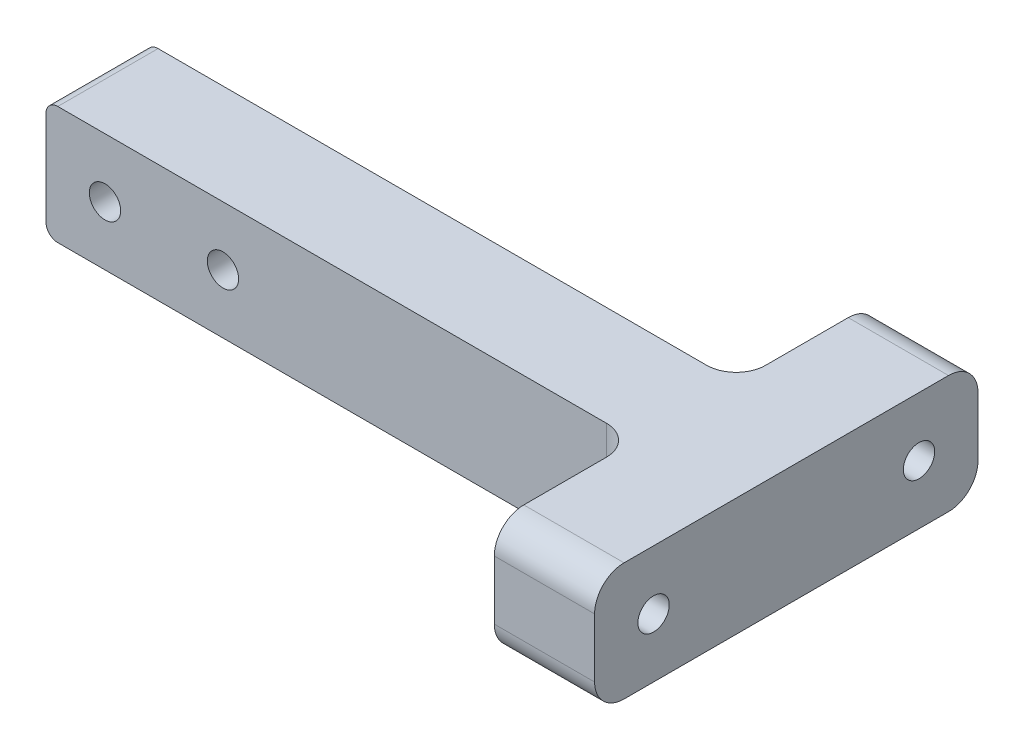
from build123d import *

# Parameters (mm, degrees)
BOSS_EXTRUDE1_DEPTH = 25.4
FILLET1_R           = 6.35
SKETCH2_R           = 3.3734375
CUT_EXTRUDE1_DEPTH  = 160.484898972
SKETCH3_R           = 3.3734375
CUT_EXTRUDE2_DEPTH  = 157.293869761
FILLET2_R           = 6.35
FILLET3_R           = 2.54


with BuildPart() as part:
    # Sketch1 → Boss-Extrude1 (new body)
    with BuildSketch(Plane(origin=(0, 0, 0), x_dir=(1, 0, 0), z_dir=(0, 1, 0))):
        Polygon((0, 10.795), (0, -10.795), (127, -10.795), (127, -41.275), (148.59, -41.275), (148.59, 41.275), (127, 41.275), (127, 10.795), align=None)
    extrude(amount=BOSS_EXTRUDE1_DEPTH)

    # Fillet1
    fillet1_edges = [part.edges().sort_by_distance(p)[0] for p in [
        (127, 12.7, -10.795),
        (127, 12.7, 10.795),
    ]]
    fillet(fillet1_edges, radius=FILLET1_R)

    # Sketch2 → Cut-Extrude1 (cut, through all)
    with BuildSketch(Plane.XY.offset(10.795)):
        with Locations((12.7, 12.7)):
            Circle(SKETCH2_R)
        with Locations((38.1, 12.7)):
            Circle(SKETCH2_R)
    extrude(amount=-CUT_EXTRUDE1_DEPTH, mode=Mode.SUBTRACT)

    # Sketch3 → Cut-Extrude2 (cut, through all)
    with BuildSketch(Plane(origin=(148.59, 0, 0), x_dir=(0, 0, -1), z_dir=(1, 0, 0))):
        with Locations((-28.575, 12.7)):
            Circle(SKETCH3_R)
        with Locations((28.575, 12.7)):
            Circle(SKETCH3_R)
    extrude(amount=-CUT_EXTRUDE2_DEPTH, mode=Mode.SUBTRACT)

    # Fillet2
    fillet2_edges = [part.edges().sort_by_distance(p)[0] for p in [
        (137.795, 25.4, 41.275),
        (137.795, 25.4, -41.275),
        (137.795, 0, -41.275),
        (137.795, 0, 41.275),
    ]]
    fillet(fillet2_edges, radius=FILLET2_R)

    # Fillet3
    fillet3_edges = [part.edges().sort_by_distance(p)[0] for p in [
        (0, 0, 0),
        (0, 25.4, 0),
    ]]
    fillet(fillet3_edges, radius=FILLET3_R)


solid = part.part
